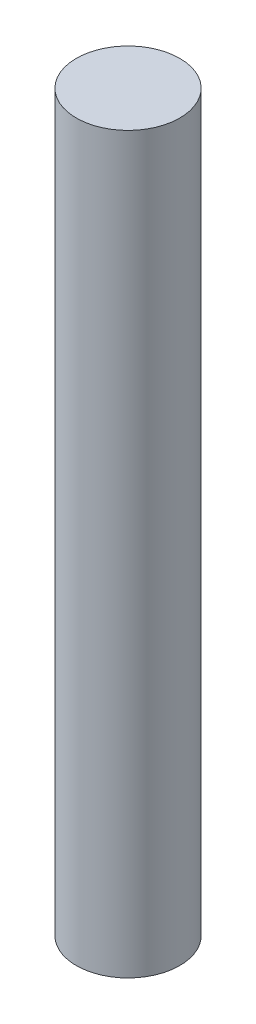
from build123d import *

# Parameters (mm, degrees)
SKETCH1_W                 = 4.7625
SKETCH1_H                 = 67.589372962
F_6_32_TAPPED_HOLE1_D     = 2.7051
F_6_32_TAPPED_HOLE1_DEPTH = 27.01925
F_6_32_TAPPED_HOLE1_TIP   = 0.81269403


with BuildPart() as part:
    # Sketch1 → Revolve1 (revolve)
    with BuildSketch(Plane(origin=(-24.412739892, 0, -3.433041547), x_dir=(0.13925483139909503, 0, -0.9902565788380351), z_dir=(0.9902565788380351, 0, 0.13925483139909503)), mode=Mode.PRIVATE) as revolve1_sk:
        with Locations((7.979763498, 25.040031321)):
            Rectangle(SKETCH1_W, SKETCH1_H)
    revolve(revolve1_sk.sketch.rotate(Axis((-22.969918704, -8.75465516, -13.693103328), (0, 1, 0)), 188.004728857), axis=Axis((-22.969918704, -8.75465516, -13.693103328), (0, 1, 0)))

    # #6-32 Tapped Hole1
    with Locations(Plane(origin=(0, -8.75465516, 0), x_dir=(-1, 0, 0), z_dir=(0, -1, 0))):
        with Locations((22.969918704, 13.693103328)):
            Hole(F_6_32_TAPPED_HOLE1_D / 2, depth=F_6_32_TAPPED_HOLE1_DEPTH)
            with Locations((0, 0, -(F_6_32_TAPPED_HOLE1_DEPTH + F_6_32_TAPPED_HOLE1_TIP / 2))):  # 118° drill point
                Cone(0, F_6_32_TAPPED_HOLE1_D / 2, F_6_32_TAPPED_HOLE1_TIP, mode=Mode.SUBTRACT)


solid = part.part
